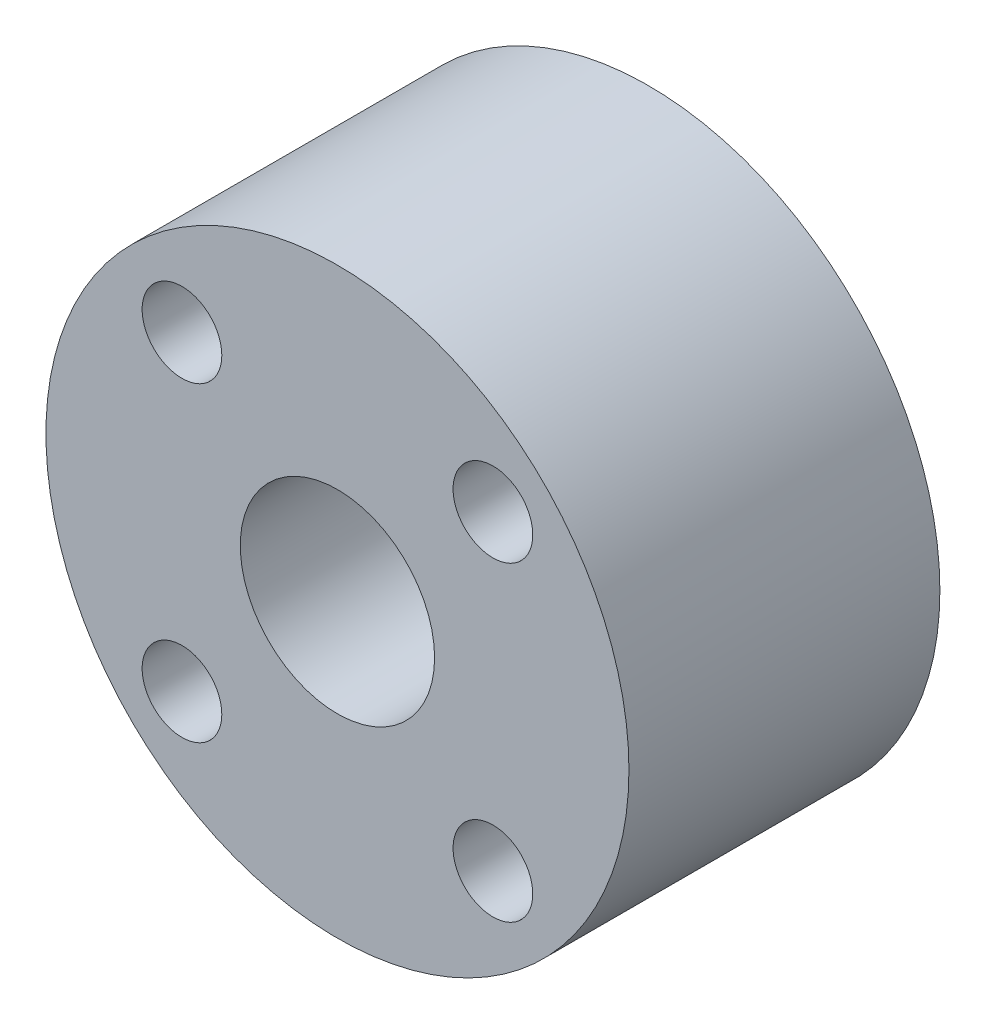
from build123d import *

# Parameters (mm, degrees)
SKETCH1_R           = 15
SKETCH1_R_2         = 2.05
SKETCH1_R_3         = 5
BOSS_EXTRUDE1_DEPTH = 16


with BuildPart() as part:
    # Sketch1 → Boss-Extrude1 (new body)
    with BuildSketch(Plane.XY):
        Circle(SKETCH1_R)
        with Locations((-8, 8)):
            Circle(SKETCH1_R_2, mode=Mode.SUBTRACT)
        with Locations((8, 8)):
            Circle(SKETCH1_R_2, mode=Mode.SUBTRACT)
        with Locations((8, -8)):
            Circle(SKETCH1_R_2, mode=Mode.SUBTRACT)
        with Locations((-8, -8)):
            Circle(SKETCH1_R_2, mode=Mode.SUBTRACT)
        Circle(SKETCH1_R_3, mode=Mode.SUBTRACT)
    extrude(amount=BOSS_EXTRUDE1_DEPTH)


solid = part.part
